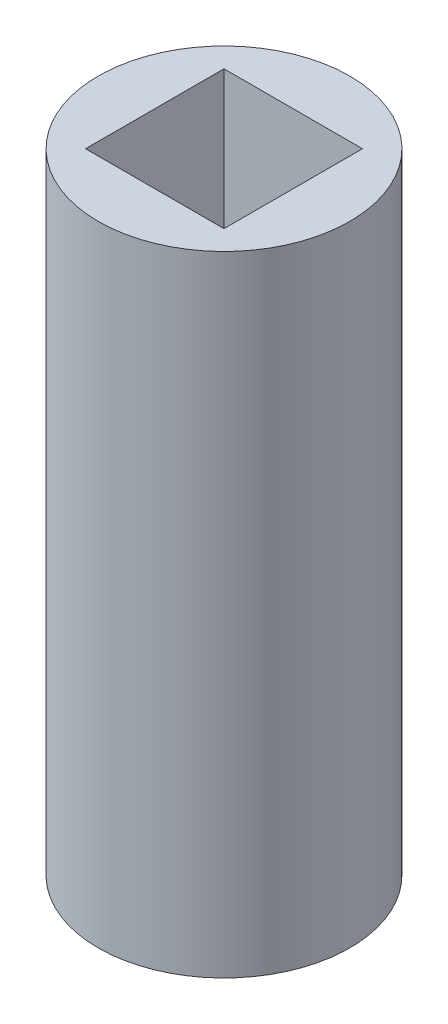
from build123d import *

# Parameters (mm, degrees)
SKETCH1_R           = 6
SKETCH1_W           = 6.6
SKETCH1_H           = 6.6
BOSS_EXTRUDE1_DEPTH = 30


with BuildPart() as part:
    # Sketch1 → Boss-Extrude1 (new body)
    with BuildSketch(Plane(origin=(0, 0, 0), x_dir=(1, 0, 0), z_dir=(0, 1, 0))):
        with Locations(Location((0, 0, 0), (0, 0, 270))):
            Circle(SKETCH1_R)
        Rectangle(SKETCH1_W, SKETCH1_H, mode=Mode.SUBTRACT)
    extrude(amount=BOSS_EXTRUDE1_DEPTH)


solid = part.part
